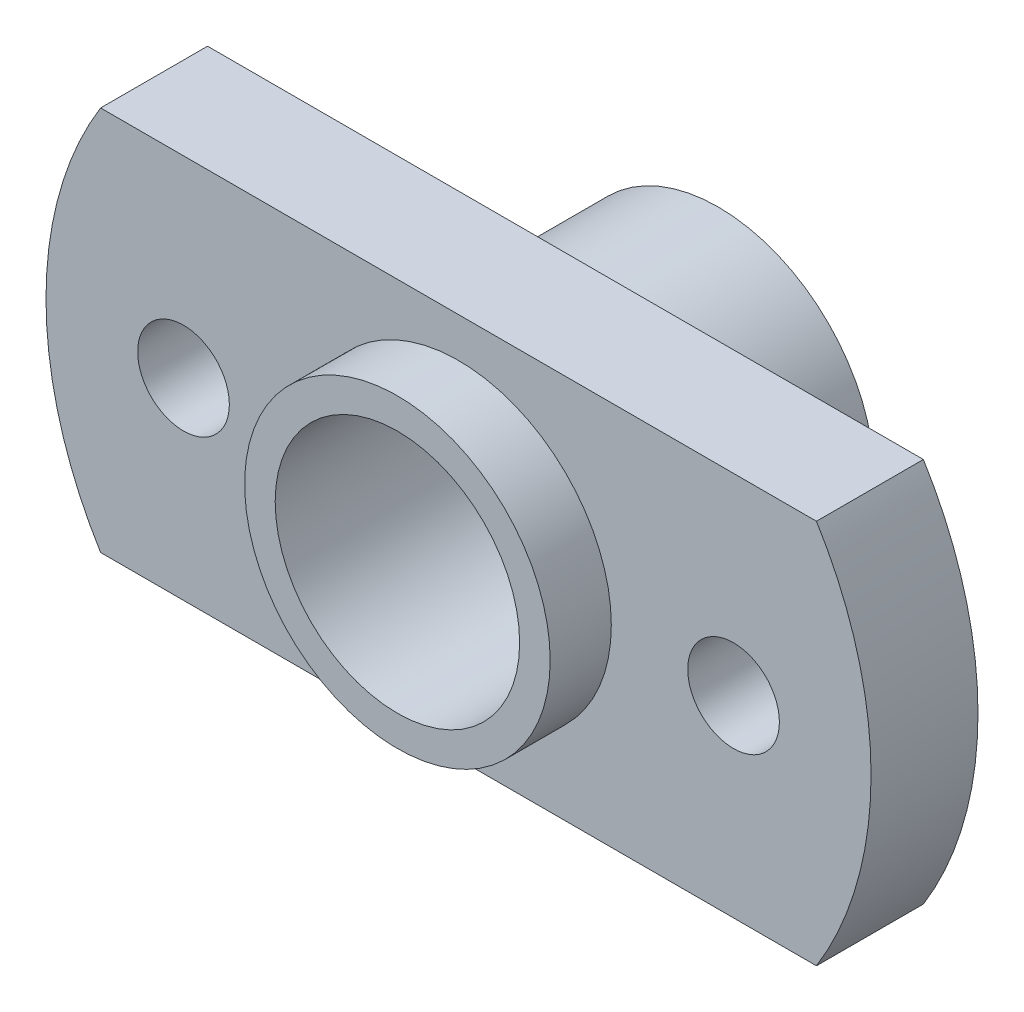
from build123d import *

# Parameters (mm, degrees)
SALIENTE_EXTRUIR1_DEPTH           = 3.5
CROQUIS2_W                        = 5
CROQUIS2_H                        = 2
CROQUIS3_W                        = 5.1
CROQUIS3_H                        = 5
DI_METRO_DE_TALADRO_3_0_3_1_D     = 3
DI_METRO_DE_TALADRO_3_0_3_1_DEPTH = 8.5
DI_METRO_DE_TALADRO_8_0_8_1_D     = 8


with BuildPart() as part:
    # Croquis1 → Saliente-Extruir1 (new body)
    with BuildSketch(Plane(origin=(0, 0, 177.026431985), x_dir=(-1, 0, 0), z_dir=(0, 0, -1))):
        with BuildLine():
            Line((177.813226718, -74.200057886), (154.386773282, -74.200057886))
            ThreePointArc((154.386773282, -74.200057886), (152.6, -80.500057886), (154.386773282, -86.800057886))
            Line((154.386773282, -86.800057886), (177.813226718, -86.800057886))
            ThreePointArc((177.813226718, -86.800057886), (179.6, -80.500057886), (177.813226718, -74.200057886))
        make_face()
    extrude(amount=-SALIENTE_EXTRUIR1_DEPTH)

    # Croquis2 → Revolución1 (revolve)
    with BuildSketch(Plane(origin=(0, -80.500057886, 0), x_dir=(1, 0, 0), z_dir=(0, 1, 0))):
        with Locations((-163.6, -181.526431985)):
            Rectangle(CROQUIS2_W, CROQUIS2_H)
    revolve(axis=Axis((-166.1, -80.500057886, 180.526431985), (0, 0, 1)))

    # Croquis3 → Revolución2 (revolve)
    with BuildSketch(Plane.XZ.offset(80.500057886), mode=Mode.PRIVATE) as revoluci_n2_sk:
        with Locations((-163.55, 174.526431985)):
            Rectangle(CROQUIS3_W, CROQUIS3_H)
    revolve(revoluci_n2_sk.sketch.rotate(Axis((-166.1, -80.500057886, 177.026431985), (0, 0, -1)), 180), axis=Axis((-166.1, -80.500057886, 177.026431985), (0, 0, -1)))

    # Diámetro de taladro Ø3.0 (3)1
    with Locations(Plane.XY.offset(180.526431985)):
        with Locations((-157.1, -80.500057886), (-175.1, -80.500057886)):
            Hole(DI_METRO_DE_TALADRO_3_0_3_1_D / 2, depth=DI_METRO_DE_TALADRO_3_0_3_1_DEPTH)

    # Diámetro de taladro Ø8.0 (8)1 (through all)
    with Locations(Plane(origin=(0, 0, 172.026431985), x_dir=(-1, 0, 0), z_dir=(0, 0, -1))):
        with Locations((166.1, -80.500057886)):
            Hole(DI_METRO_DE_TALADRO_8_0_8_1_D / 2)


solid = part.part
